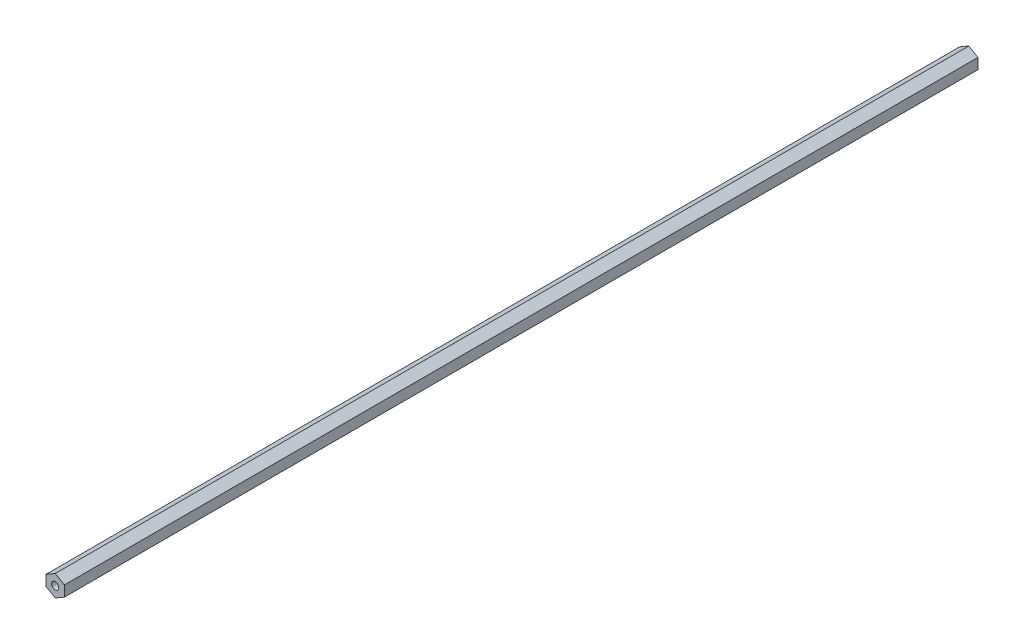
from build123d import *

# Parameters (mm, degrees)
BOSS_EXTRUDE1_DEPTH = 315.9125
SKETCH2_R           = 2.4892
CUT_EXTRUDE1_DEPTH  = 19.05


with BuildPart() as part:
    # Sketch1 → Boss-Extrude1 (new, symmetric)
    with BuildSketch(Plane.XY):
        Polygon((6.35, -3.666174209), (6.35, 3.666174209), (0, 7.332348419), (-6.35, 3.666174209), (-6.35, -3.666174209), (0, -7.332348419), align=None)
    extrude(amount=BOSS_EXTRUDE1_DEPTH, both=True)

    # Sketch2 → Cut-Extrude1 (cut)
    with BuildSketch(Plane.XY.offset(315.9125)):
        Circle(SKETCH2_R)
    cut_extrude1 = extrude(amount=-CUT_EXTRUDE1_DEPTH, mode=Mode.SUBTRACT)

    # Mirror1: Cut-Extrude1 across plane
    add(cut_extrude1.mirror(Plane.XY), mode=Mode.SUBTRACT)


solid = part.part
